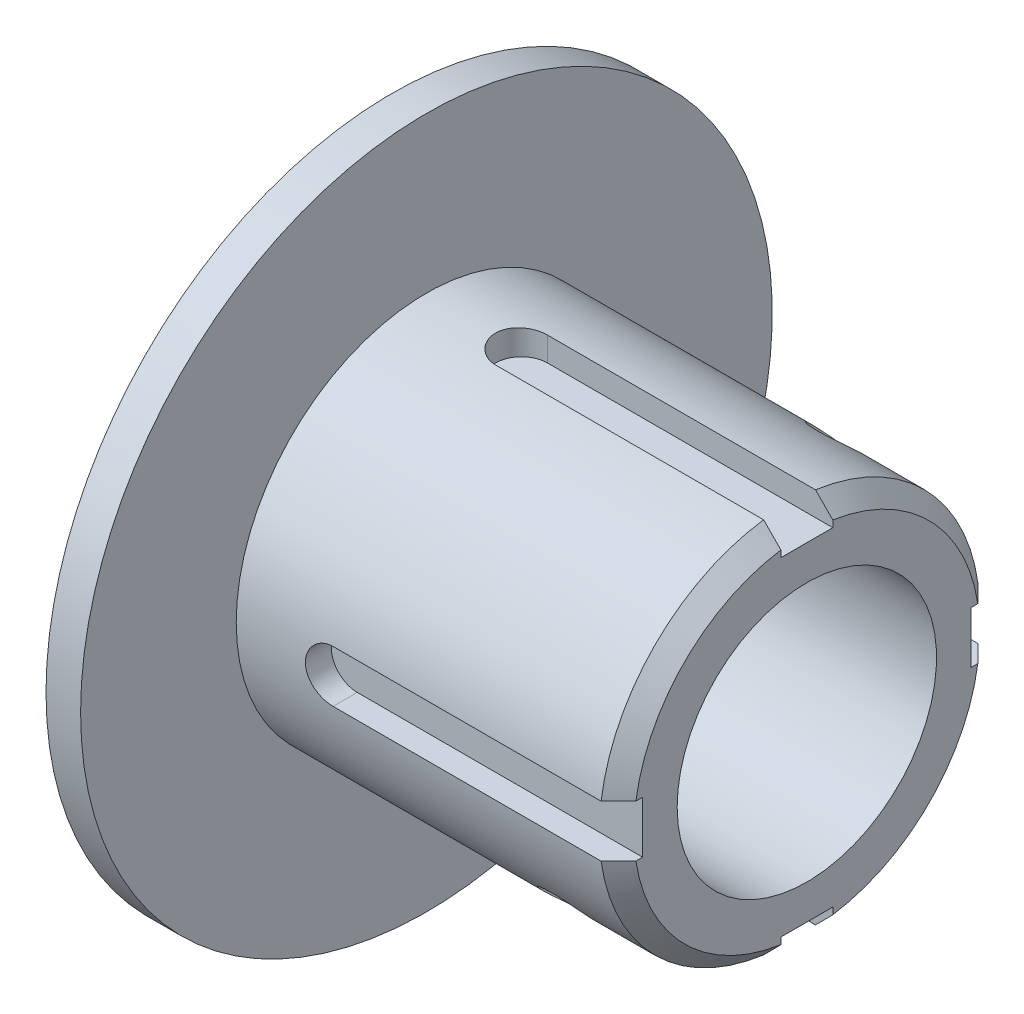
from build123d import *

# Parameters (mm, degrees)
ENL_V_MAT_EXTRU_1_DEPTH      = 3
R_P_TITION_CIRCULAIRE1_COUNT = 4
ESQUISSE5_R                  = 3
ENL_V_MAT_EXTRU_2_DEPTH      = 40


with BuildPart() as part:
    # Esquisse1 → Base-Révolution (revolve)
    with BuildSketch(Plane.XY, mode=Mode.PRIVATE) as base_r_volution_sk:
        Polygon((0, 40), (-4, 40), (-10, 23.515135483), (-10, 15), (44, 15), (44, 20), (42, 22), (0, 22), align=None)
    revolve(base_r_volution_sk.sketch.rotate(Axis((0, 0, 0), (1, 0, 0)), 90), axis=Axis((0, 0, 0), (1, 0, 0)))

    # Esquisse3 → Enlèv. mat.-Extru.1 (cut)
    with BuildSketch(Plane(origin=(21, 22, 0), x_dir=(0, 0, -1), z_dir=(0, 1, 0))):
        with BuildLine():
            Line((-3, -25), (3, -25))
            Line((3, -25), (3, 10))
            ThreePointArc((3, 10), (0, 13), (-3, 10))
            Line((-3, 10), (-3, -25))
        make_face()
    enl_v_mat_extru_1 = extrude(amount=-ENL_V_MAT_EXTRU_1_DEPTH, mode=Mode.SUBTRACT)

    # Répétition circulaire1: Enlèv. mat.-Extru.1 ×4 about axis
    r_p_tition_circulaire1_axis = Axis((0, 0, 0), (1, 0, 0))
    for i in range(1, R_P_TITION_CIRCULAIRE1_COUNT):
        add(enl_v_mat_extru_1.rotate(r_p_tition_circulaire1_axis, i * 360 / R_P_TITION_CIRCULAIRE1_COUNT), mode=Mode.SUBTRACT)

    # Esquisse5 → Enlèv. mat.-Extru.2 (cut, symmetric)
    with BuildSketch(Plane(origin=(0, 0, 0), x_dir=(1, 0, 0), z_dir=(0, -0.7071067811865488, 0.7071067811865462))):
        with Locations(Location((32, 0, 0), (0, 0, 270))):
            Circle(ESQUISSE5_R)
    extrude(amount=ENL_V_MAT_EXTRU_2_DEPTH, both=True, mode=Mode.SUBTRACT)


solid = part.part
